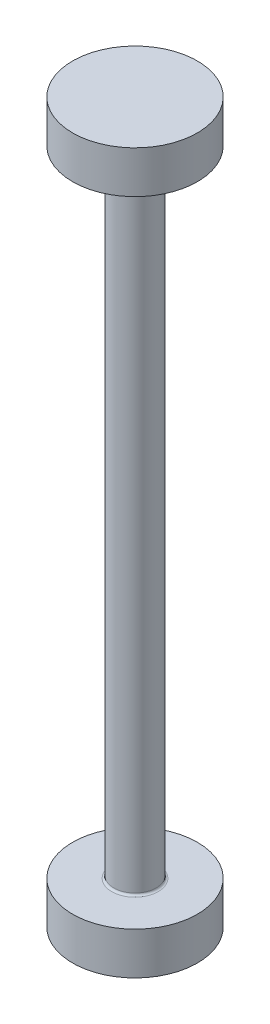
from build123d import *

# Parameters (mm, degrees)
SKETCH_1_R      = 29.5
EXTRUDE_1_DEPTH = 20
SKETCH_3_R      = 10
EXTRUDE_2_DEPTH = 300
SKETCH_4_R      = 29.5
EXTRUDE_3_DEPTH = 20
FILLET_1_R      = 1


with BuildPart() as part:
    # 草图1 → 凸台-拉伸1 (new body)
    with BuildSketch(Plane.XZ.offset(-1690.101215638)):
        with Locations(Location((0, 0, 0), (0, 0, 270))):
            Circle(SKETCH_1_R)
    extrude(amount=-EXTRUDE_1_DEPTH)

    # 草图3 → 凸台-拉伸2 (add)
    with BuildSketch(Plane(origin=(0, 1710.101215638, 0), x_dir=(1, 0, 0), z_dir=(0, 1, 0))):
        with Locations(Location((0, 0, 0), (0, 0, 270))):
            Circle(SKETCH_3_R)
    extrude(amount=EXTRUDE_2_DEPTH)

    # 草图4 → 凸台-拉伸3 (add)
    with BuildSketch(Plane(origin=(0, 2010.101215638, 0), x_dir=(1, 0, 0), z_dir=(0, 1, 0))):
        with Locations(Location((0, 0, 0), (0, 0, 90))):
            Circle(SKETCH_4_R)
    extrude(amount=EXTRUDE_3_DEPTH)

    # 圆角1
    fillet_1_edges = [part.edges().sort_by_distance(p)[0] for p in [
        (0, 1710.101215638, -10),
        (0, 2010.101215638, -10),
    ]]
    fillet(fillet_1_edges, radius=FILLET_1_R)


solid = part.part
